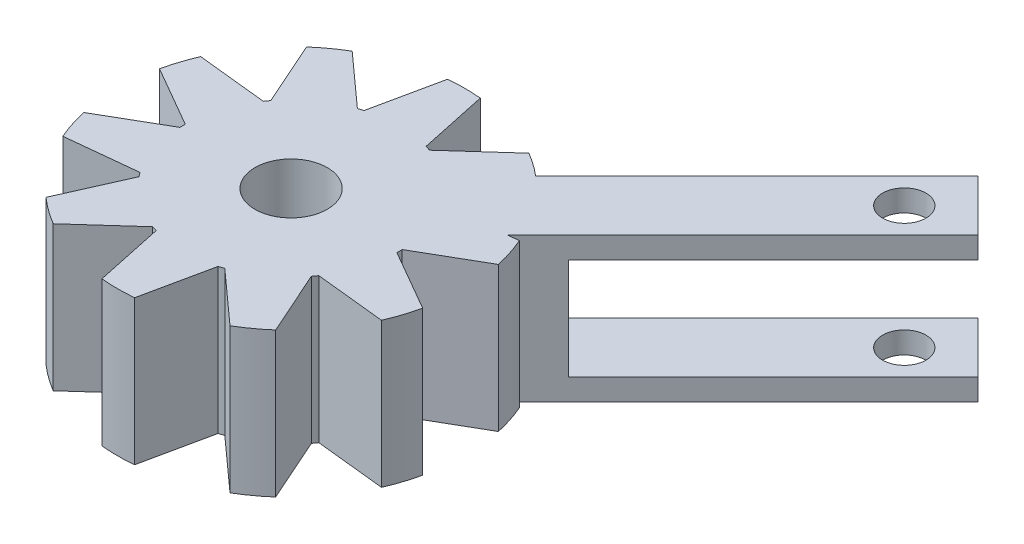
from build123d import *

# Parameters (mm, degrees)
SKETCH1_R           = 2.5
BOSS_EXTRUDE1_DEPTH = 10
BOSS_EXTRUDE2_DEPTH = 10
SKETCH3_R           = 1.5
CUT_EXTRUDE1_DEPTH  = 55
SKETCH4_W           = 40
SKETCH4_H           = 7
CUT_EXTRUDE2_DEPTH  = 10


with BuildPart() as part:
    # Sketch1 → Boss-Extrude1 (new body)
    # profile 1 of 2: a face of its own
    with BuildSketch(Plane(origin=(0, 0, 0), x_dir=(1, 0, 0), z_dir=(0, 1, 0))):
        with BuildLine():
            Line((1.57, 9.875986027), (-1.57, 9.875986027))
            Line((-1.57, 9.875986027), (-2.141392001, 7.187798015))
            ThreePointArc((-2.141392001, 7.187798015), (-2.317627458, 7.132923872), (-2.492459149, 7.073729383))
            Line((-2.492459149, 7.073729383), (-6.108014237, 10.329189807))
            ThreePointArc((-6.108014237, 10.329189807), (-7.053423028, 9.708203932), (-7.936163073, 9.000961931))
            Line((-7.936163073, 9.000961931), (-5.95730419, 4.556372108))
            ThreePointArc((-5.95730419, 4.556372108), (-6.067627458, 4.408389392), (-6.17427562, 4.257736555))
            Line((-6.17427562, 4.257736555), (-11.012832757, 4.766289403))
            ThreePointArc((-11.012832757, 4.766289403), (-11.412678196, 3.708203932), (-11.711123476, 2.617171553))
            Line((-11.711123476, 2.617171553), (-7.497728659, 0.184566922))
            ThreePointArc((-7.497728659, 0.184566922), (-7.5, 0), (-7.497728659, -0.184566922))
            Line((-7.497728659, -0.184566922), (-11.711123476, -2.617171553))
            ThreePointArc((-11.711123476, -2.617171553), (-11.412678196, -3.708203932), (-11.012832757, -4.766289403))
            Line((-11.012832757, -4.766289403), (-6.17427562, -4.257736555))
            ThreePointArc((-6.17427562, -4.257736555), (-6.067627458, -4.408389392), (-5.95730419, -4.556372108))
            Line((-5.95730419, -4.556372108), (-7.936163073, -9.000961931))
            ThreePointArc((-7.936163073, -9.000961931), (-7.053423028, -9.708203932), (-6.108014237, -10.329189807))
            Line((-6.108014237, -10.329189807), (-2.492459149, -7.073729383))
            ThreePointArc((-2.492459149, -7.073729383), (-2.317627458, -7.132923872), (-2.141392001, -7.187798015))
            Line((-2.141392001, -7.187798015), (-1.129858117, -11.946690782))
            ThreePointArc((-1.129858117, -11.946690782), (0, -12), (1.129858117, -11.946690782))
            Line((1.129858117, -11.946690782), (2.141392001, -7.187798015))
            ThreePointArc((2.141392001, -7.187798015), (2.317627458, -7.132923872), (2.492459149, -7.073729383))
            Line((2.492459149, -7.073729383), (6.108014237, -10.329189807))
            ThreePointArc((6.108014237, -10.329189807), (7.053423028, -9.708203932), (7.936163073, -9.000961931))
            Line((7.936163073, -9.000961931), (5.95730419, -4.556372108))
            ThreePointArc((5.95730419, -4.556372108), (6.067627458, -4.408389392), (6.17427562, -4.257736555))
            Line((6.17427562, -4.257736555), (11.012832757, -4.766289403))
            ThreePointArc((11.012832757, -4.766289403), (11.412678196, -3.708203932), (11.711123476, -2.617171553))
            Line((11.711123476, -2.617171553), (7.497728659, -0.184566922))
            ThreePointArc((7.497728659, -0.184566922), (7.5, 0), (7.497728659, 0.184566922))
            Line((7.497728659, 0.184566922), (11.711123476, 2.617171553))
            ThreePointArc((11.711123476, 2.617171553), (11.412678196, 3.708203932), (11.012832757, 4.766289403))
            Line((11.012832757, 4.766289403), (6.17427562, 4.257736555))
            ThreePointArc((6.17427562, 4.257736555), (6.067627458, 4.408389392), (5.95730419, 4.556372108))
            Line((5.95730419, 4.556372108), (7.936163073, 9.000961931))
            ThreePointArc((7.936163073, 9.000961931), (7.053423028, 9.708203932), (6.108014237, 10.329189807))
            Line((6.108014237, 10.329189807), (2.492459149, 7.073729383))
            ThreePointArc((2.492459149, 7.073729383), (2.317627458, 7.132923872), (2.141392001, 7.187798015))
            Line((2.141392001, 7.187798015), (1.57, 9.875986027))
        make_face()
        with Locations(Location((0, 0, 0), (0, 0, 270))):
            Circle(SKETCH1_R, mode=Mode.SUBTRACT)
    # profile 2 of 2: a face of its own
    with BuildSketch(Plane(origin=(0, 0, 0), x_dir=(1, 0, 0), z_dir=(0, 1, 0))):
        with BuildLine():
            Line((-1.129858117, 11.946690782), (-1.57, 9.875986027))
            Line((-1.57, 9.875986027), (1.57, 9.875986027))
            Line((1.57, 9.875986027), (1.129858117, 11.946690782))
            ThreePointArc((1.129858117, 11.946690782), (0, 12), (-1.129858117, 11.946690782))
        make_face()
    extrude(amount=BOSS_EXTRUDE1_DEPTH)

    # Sketch2 → Boss-Extrude2 (add)
    with BuildSketch(Plane(origin=(0, 10, 0), x_dir=(1, 0, 0), z_dir=(0, 1, 0))):
        Polygon((1.781492434, 3.263264717), (22.99469587, 24.476468153), (26.530229776, 20.940934247), (5.31702634, -0.272269189), align=None)
    extrude(amount=-BOSS_EXTRUDE2_DEPTH)

    # Sketch3 → Cut-Extrude1 (cut)
    with BuildSketch(Plane(origin=(0, 10, 0), x_dir=(1, 0, 0), z_dir=(0, 1, 0))):
        with Locations(Location((22.215215239, 20.161453616, 0), (0, 0, 270))):
            Circle(SKETCH3_R)
    extrude(amount=-CUT_EXTRUDE1_DEPTH, mode=Mode.SUBTRACT)

    # Sketch4 → Cut-Extrude2 (cut)
    with BuildSketch(Plane(origin=(2.794647764, 0, 2.794647764), x_dir=(0.7071067811865461, 0, -0.707106781186549), z_dir=(0.707106781186549, 0, 0.7071067811865461))):
        with Locations((33.567181991, 5)):
            Rectangle(SKETCH4_W, SKETCH4_H)
    extrude(amount=-CUT_EXTRUDE2_DEPTH, mode=Mode.SUBTRACT)


solid = part.part
